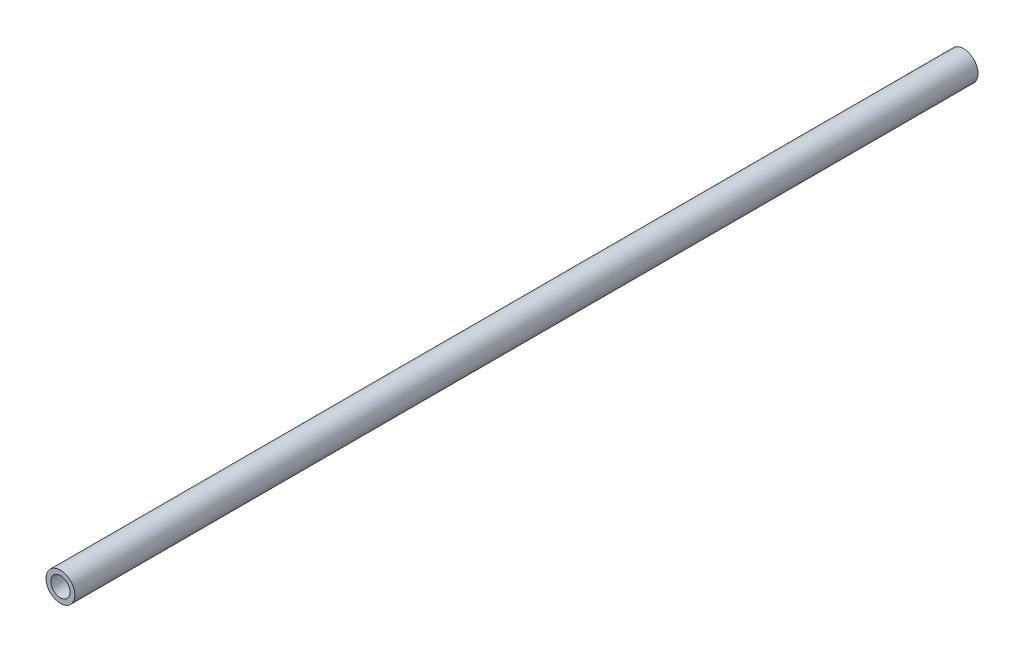
from build123d import *

# Parameters (mm, degrees)
SKETCH1_R           = 7.5
SKETCH1_R_2         = 5
BOSS_EXTRUDE1_DEPTH = 470


with BuildPart() as part:
    # Sketch1 → Boss-Extrude1 (new body)
    with BuildSketch(Plane.XY):
        with Locations(Location((390.7614039, 31.081528881, 0), (0, 0, 180))):
            Circle(SKETCH1_R)
        with Locations(Location((390.7614039, 31.081528881, 0), (0, 0, 180))):
            Circle(SKETCH1_R_2, mode=Mode.SUBTRACT)
    extrude(amount=BOSS_EXTRUDE1_DEPTH)


solid = part.part
